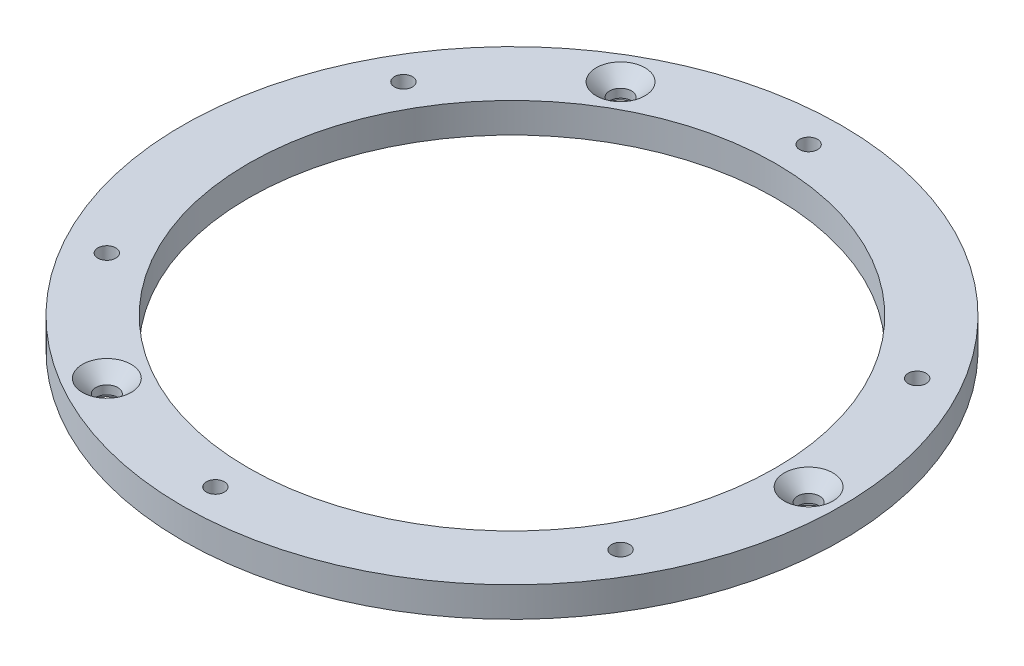
from build123d import *

# Parameters (mm, degrees)
SKETCH1_R                                            = 165
SKETCH1_R_2                                          = 132
BOSS_EXTRUDE1_DEPTH                                  = 15
M8_CLEARANCE_HOLE1_D                                 = 9
CIRPATTERN1_COUNT                                    = 6
SKETCH4_R                                            = 10
CUT_EXTRUDE1_DEPTH                                   = 4
CSK_FOR_M10_HEX_SOCKET_COUNTERSUNK_CAP_S_D           = 11
CSK_FOR_M10_HEX_SOCKET_COUNTERSUNK_CAP_S_CSINK_D     = 24.4
CSK_FOR_M10_HEX_SOCKET_COUNTERSUNK_CAP_S_CSINK_ANGLE = 90
CIRPATTERN2_COUNT                                    = 3


with BuildPart() as part:
    # Sketch1 → Boss-Extrude1 (new body)
    with BuildSketch(Plane(origin=(0, 0, 0), x_dir=(1, 0, 0), z_dir=(0, 1, 0))):
        with Locations(Location((0, 0, 0), (0, 0, 270))):
            Circle(SKETCH1_R)
        with Locations(Location((0, 0, 0), (0, 0, 270))):
            Circle(SKETCH1_R_2, mode=Mode.SUBTRACT)
    extrude(amount=BOSS_EXTRUDE1_DEPTH)

    # M8 Clearance Hole1 (through all)
    with Locations(Plane(origin=(0, 0, 0), x_dir=(-1, 0, 0), z_dir=(0, -1, 0))):
        with Locations((0, 148.5)):
            m8_clearance_hole1 = Hole(M8_CLEARANCE_HOLE1_D / 2)

    # CirPattern1: M8 Clearance Hole1 ×6 about axis
    cirpattern1_axis = Axis((0, 0, 0), (0, 1, 0))
    for i in range(1, CIRPATTERN1_COUNT):
        add(m8_clearance_hole1.rotate(cirpattern1_axis, i * 360 / CIRPATTERN1_COUNT), mode=Mode.SUBTRACT)

    # Sketch4 → Cut-Extrude1 (cut)
    with BuildSketch(Plane.XZ):
        with Locations(Location((-74.25, 128.604772462, 0), (0, 0, 270))):
            Circle(SKETCH4_R)
    cut_extrude1 = extrude(amount=-CUT_EXTRUDE1_DEPTH, mode=Mode.SUBTRACT)

    # CSK for M10 Hex Socket Countersunk Cap Screw1 (through all)
    with Locations(Plane(origin=(0, 15, 0), x_dir=(1, 0, 0), z_dir=(0, 1, 0))):
        with Locations((-74.25, -128.604772462)):
            csk_for_m10_hex_socket_countersunk_cap_s = CounterSinkHole(CSK_FOR_M10_HEX_SOCKET_COUNTERSUNK_CAP_S_D / 2, CSK_FOR_M10_HEX_SOCKET_COUNTERSUNK_CAP_S_CSINK_D / 2, counter_sink_angle=CSK_FOR_M10_HEX_SOCKET_COUNTERSUNK_CAP_S_CSINK_ANGLE)

    # CirPattern2: Cut-Extrude1, CSK for M10 Hex Socket Countersunk Cap Screw1 ×3 about axis
    cirpattern2_axis = Axis((0, 0, 0), (0, 1, 0))
    add([cut_extrude1.rotate(cirpattern2_axis, i * 360 / CIRPATTERN2_COUNT) for i in range(1, CIRPATTERN2_COUNT)], mode=Mode.SUBTRACT)
    add([csk_for_m10_hex_socket_countersunk_cap_s.rotate(cirpattern2_axis, i * 360 / CIRPATTERN2_COUNT) for i in range(1, CIRPATTERN2_COUNT)], mode=Mode.SUBTRACT)


solid = part.part
